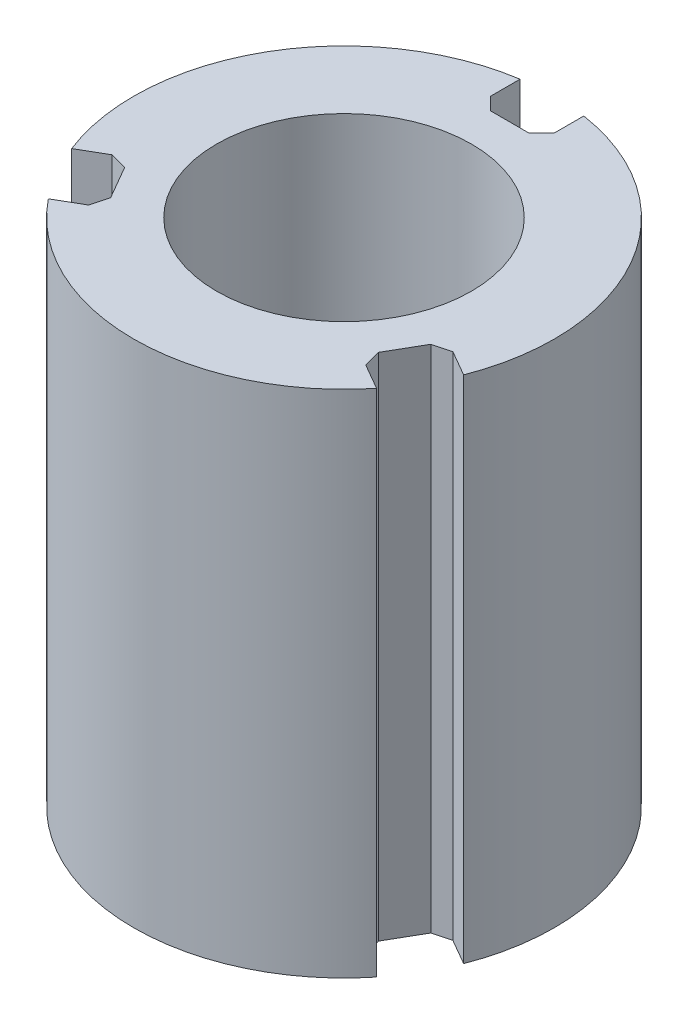
from build123d import *

# Parameters (mm, degrees)
SKETCH1_R           = 2
BOSS_EXTRUDE1_DEPTH = 8


with BuildPart() as part:
    # Sketch1 → Boss-Extrude1 (new body)
    with BuildSketch(Plane(origin=(0, 0, 0), x_dir=(1, 0, 0), z_dir=(0, 1, 0))):
        with BuildLine():
            Line((-0.5, 2.8), (-0.3, 2.6))
            Line((-0.3, 2.6), (0.3, 2.6))
            Line((0.3, 2.6), (0.5, 2.8))
            Line((0.5, 2.8), (0.5, 3.261901286))
            ThreePointArc((0.5, 3.261901286), (2.857883832, 1.65), (3.074889378, -1.197937941))
            Line((3.074889378, -1.197937941), (2.674871131, -0.966987298))
            Line((2.674871131, -0.966987298), (2.40166605, -1.040192379))
            Line((2.40166605, -1.040192379), (2.10166605, -1.559807621))
            Line((2.10166605, -1.559807621), (2.174871131, -1.833012702))
            Line((2.174871131, -1.833012702), (2.574889378, -2.063963345))
            ThreePointArc((2.574889378, -2.063963345), (0, -3.3), (-2.574889378, -2.063963345))
            Line((-2.574889378, -2.063963345), (-2.174871131, -1.833012702))
            Line((-2.174871131, -1.833012702), (-2.10166605, -1.559807621))
            Line((-2.10166605, -1.559807621), (-2.40166605, -1.040192379))
            Line((-2.40166605, -1.040192379), (-2.674871131, -0.966987298))
            Line((-2.674871131, -0.966987298), (-3.074889378, -1.197937941))
            ThreePointArc((-3.074889378, -1.197937941), (-2.857883832, 1.65), (-0.5, 3.261901286))
            Line((-0.5, 3.261901286), (-0.5, 2.8))
        make_face()
        with Locations(Location((0, 0, 0), (0, 0, 270))):
            Circle(SKETCH1_R, mode=Mode.SUBTRACT)
    extrude(amount=BOSS_EXTRUDE1_DEPTH)


solid = part.part
